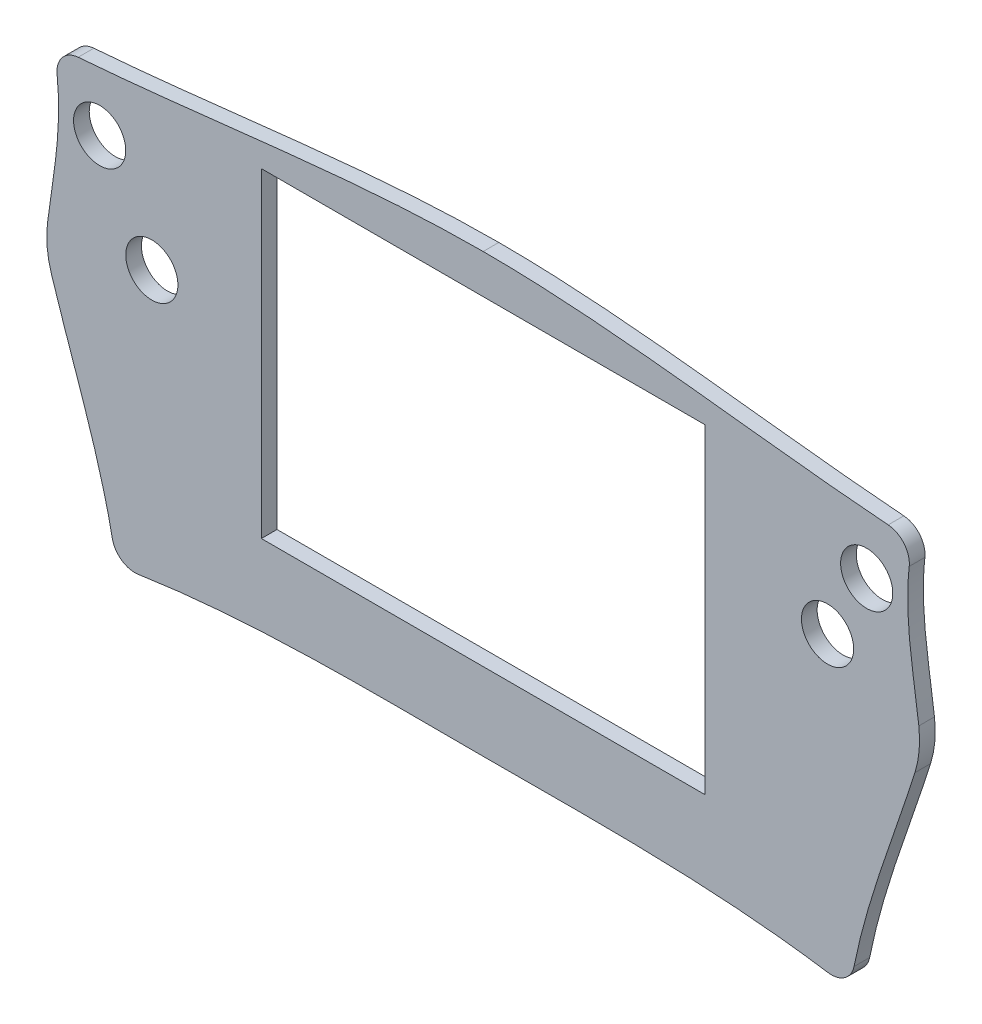
from build123d import *

# Parameters (mm, degrees)
SKETCH1_R           = 6.35
SKETCH1_W           = 107.95
SKETCH1_H           = 77.978
BOSS_EXTRUDE1_DEPTH = 3.81


with BuildPart() as part:
    # Sketch1 → Boss-Extrude1 (new body)
    with BuildSketch(Plane.XY):
        with BuildLine():
            ThreePointArc((-90.247945126, 1.580161299), (-87.975141882, -1.900637883), (-83.927585414, -2.848732901))
            add(Edge.make_bspline(
                [(-83.927585414, -2.848732901), (-83.054070471, -2.715786742), (-81.312732205, -2.460099658), (-78.654295906, -2.097457818), (-75.966491195, -1.758240891), (-72.336992818, -1.336160635), (-68.643939449, -0.959865866), (-65.583983691, -0.690535221), (-64.166779255, -0.573734085), (-63.566148315, -0.525577724), (-63.104217983, -0.489316665), (-62.699894104, -0.457970525), (-61.962459601, -0.401810292), (-60.915867879, -0.325087188), (-59.217621249, -0.20679221), (-57.068227268, -0.068668175), (-54.439670256, 0.082013873), (-51.767032951, 0.217415022), (-49.490906759, 0.318006821), (-48.009034739, 0.376639561), (-47.303600356, 0.403182815), (-46.87624745, 0.418937653), (-46.196192411, 0.443333549), (-45.175910497, 0.47801298), (-43.54019985, 0.529440772), (-41.442918551, 0.587830962), (-38.856544752, 0.647964805), (-36.195775126, 0.698343729), (-33.919375463, 0.73216057), (-32.406847373, 0.750213929), (-31.706246722, 0.757752509), (-31.408404648, 0.760817662), (-31.181163199, 0.763075054), (-31.021391801, 0.764629932), (-30.707730066, 0.767603553), (-30.26986268, 0.771505625), (-29.546357408, 0.777455403), (-28.619562792, 0.78413893), (-27.465024779, 0.791021083), (-25.871235622, 0.798660769), (-23.776420321, 0.805345875), (-21.095419523, 0.808788849), (-18.730229007, 0.807870354), (-16.988945077, 0.805198844), (-16.118237596, 0.803410927), (-15.586446283, 0.802172614), (-15.160582097, 0.801119107), (-14.629388092, 0.799779587), (-13.778859371, 0.797542602), (-12.290567631, 0.793391761), (-10.165619586, 0.786950406), (-7.609712384, 0.777596832), (-4.232901772, 0.76670962), (-1.692574695, 0.762894866), (-0.000735939, 0.762000495)],
                knots=[0.344883789, 0.344883789, 0.344883789, 0.344883789, 0.365355884, 0.385827978, 0.406300073, 0.426772167, 0.467716357, 0.488188451, 0.493306475, 0.498424499, 0.50098351, 0.503542522, 0.508660546, 0.518896593, 0.529132641, 0.549604735, 0.57007683, 0.590548924, 0.611021019, 0.621257066, 0.623816078, 0.62637509, 0.631493114, 0.641729161, 0.651965208, 0.672437303, 0.692909397, 0.713381492, 0.733853587, 0.744089634, 0.746648646, 0.749207658, 0.750487163, 0.751766669, 0.754325681, 0.759443705, 0.764561728, 0.774797776, 0.785033823, 0.79526987, 0.815741965, 0.83621406, 0.856686154, 0.866922202, 0.872040225, 0.874599237, 0.877158249, 0.882276272, 0.887394296, 0.897630343, 0.918102438, 0.938574533, 0.959046627, 0.999990816, 0.999990816, 0.999990816, 0.999990816], degree=3))
            add(Edge.make_bspline(
                [(-0.000735939, 0.762000495), (1.697316836, 0.766177734), (4.244409913, 0.77253852), (7.640476943, 0.781209392), (10.187668405, 0.787807526), (12.309879884, 0.793384892), (13.796306461, 0.797330932), (14.644321151, 0.799597123), (15.177550854, 0.80101974), (15.596748301, 0.802157809), (16.118287, 0.803504136), (16.973995966, 0.80545727), (18.68829658, 0.808424504), (21.027999055, 0.809635512), (23.697872289, 0.806345409), (25.799893716, 0.79962074), (27.409267347, 0.791849991), (28.580317931, 0.784820707), (29.525162279, 0.777971464), (30.265021199, 0.771870135), (30.715280941, 0.767851736), (31.035813921, 0.764814821), (31.203310927, 0.763185732), (31.424674383, 0.760990419), (31.725461502, 0.75790149), (32.424670998, 0.75038892), (33.939142843, 0.732342076), (36.215243056, 0.698563653), (38.877142881, 0.648210549), (41.464408025, 0.588096862), (43.562364845, 0.52972496), (45.199123553, 0.478290291), (46.218966314, 0.443646588), (46.900949422, 0.419191941), (47.325920748, 0.403533269), (48.032310107, 0.376969373), (49.513622078, 0.318385817), (51.790729101, 0.217796458), (54.463869347, 0.082412308), (57.093216384, -0.068273652), (59.243322334, -0.206412508), (60.942131401, -0.324720902), (61.989228303, -0.401465522), (62.726751965, -0.457620494), (63.131559362, -0.488998275), (63.592361081, -0.52516306), (64.193703385, -0.573365144), (65.61087209, -0.690141767), (68.671780552, -0.959508913), (72.365460908, -1.33583339), (75.995808252, -1.757987944), (78.68423516, -2.097273121), (81.343310776, -2.459998054), (83.085085672, -2.715750704), (83.958817154, -2.848731481)],
                knots=[9.152e-06, 9.152e-06, 9.152e-06, 9.152e-06, 0.040956877, 0.06143074, 0.081904603, 0.102378465, 0.112615397, 0.117733862, 0.122852328, 0.125411561, 0.127970794, 0.133089259, 0.143326191, 0.163800053, 0.184273916, 0.204747779, 0.21498471, 0.225221641, 0.235458573, 0.240577038, 0.245695504, 0.248254737, 0.249534353, 0.25081397, 0.253373202, 0.255932435, 0.266169367, 0.286643229, 0.307117092, 0.327590954, 0.348064817, 0.358301748, 0.36853868, 0.373657145, 0.376216378, 0.378775611, 0.389012542, 0.409486405, 0.429960268, 0.45043413, 0.470907993, 0.481144924, 0.491381856, 0.496500321, 0.499059554, 0.501618787, 0.506737253, 0.511855718, 0.532329581, 0.573277306, 0.593751169, 0.614225032, 0.634698894, 0.655172757, 0.655172757, 0.655172757, 0.655172757], degree=3))
            ThreePointArc((83.958817154, -2.848731481), (88.006379638, -1.900641004), (90.279187133, 1.58016116))
            add(Edge.make_bspline(
                [(90.279187133, 1.58016116), (90.707255223, 3.721330409), (91.671139987, 8.001579794), (93.903510476, 16.331728227), (97.14338237, 26.467199173), (100.58708015, 36.306691054), (103.244940111, 44.084996329), (104.500326759, 47.928352327), (105.108428455, 49.864950567)],
                knots=[-0.293557602, -0.293557602, -0.293557602, -0.293557602, -0.147731648, -0.001905695, 0.289746211, 0.581398118, 0.727224071, 0.873050024, 0.873050024, 0.873050024, 0.873050024], degree=3))
            ThreePointArc((105.108428455, 49.864950567), (106.136144084, 54.985756874), (106.061342514, 60.208137689))
            add(Edge.make_bspline(
                [(106.061342514, 60.208137689), (105.911666294, 61.444092118), (105.583988035, 63.887611007), (104.845109607, 68.962564326), (103.906894516, 75.52680744), (103.330597064, 82.448292199), (103.345249689, 87.49082735), (103.504349867, 90.423192606), (103.641008775, 91.919668099), (103.72344879, 92.661964135)],
                knots=[0.224037882, 0.224037882, 0.224037882, 0.224037882, 0.367934399, 0.511830915, 0.799623948, 1.087416981, 1.231313498, 1.303261756, 1.375210014, 1.375210014, 1.375210014, 1.375210014], degree=3))
            ThreePointArc((103.72344879, 92.661964135), (102.473247846, 96.843092134), (98.598214744, 98.850317136))
            add(Edge.make_bspline(
                [(98.598214744, 98.850317136), (94.416094473, 99.172048045), (86.049981349, 99.919191974), (69.422551197, 101.674055975), (48.779184165, 104.086919071), (28.344626534, 106.081432238), (12.109022695, 107.012529299), (4.052738444, 107.190075663), (0.015621033, 107.190075663)],
                knots=[0.21837869, 0.21837869, 0.21837869, 0.21837869, 0.316081353, 0.413784017, 0.609189345, 0.804594672, 0.902297336, 1, 1, 1, 1], degree=3))
            add(Edge.make_bspline(
                [(0.015621033, 107.190075663), (-4.021496378, 107.190075663), (-12.077780629, 107.012529299), (-28.313384468, 106.081432237), (-48.747942099, 104.08691907), (-69.39130913, 101.674055973), (-86.018739283, 99.919191972), (-94.384852407, 99.172048042), (-98.566972677, 98.850317134)],
                knots=[0, 0, 0, 0, 0.097702664, 0.195405328, 0.390810655, 0.586215983, 0.683918647, 0.78162131, 0.78162131, 0.78162131, 0.78162131], degree=3))
            ThreePointArc((-98.566972677, 98.850317134), (-102.442005779, 96.843092132), (-103.692206724, 92.661964133))
            add(Edge.make_bspline(
                [(-103.692206724, 92.661964133), (-103.609766709, 91.919668097), (-103.4731078, 90.423192604), (-103.314007622, 87.490827347), (-103.299354998, 82.448292195), (-103.875652451, 75.526807436), (-104.813867543, 68.962564321), (-105.552745972, 63.887611001), (-105.880424231, 61.444092112), (-106.030100451, 60.208137683)],
                knots=[-0.375210014, -0.375210014, -0.375210014, -0.375210014, -0.303261756, -0.231313498, -0.087416981, 0.200376052, 0.488169085, 0.632065601, 0.775962118, 0.775962118, 0.775962118, 0.775962118], degree=3))
            ThreePointArc((-106.030100451, 60.208137683), (-106.104902022, 54.985756873), (-105.077186396, 49.864950571))
            add(Edge.make_bspline(
                [(-105.077186396, 49.864950571), (-104.469084703, 47.928352336), (-103.213698061, 44.084996348), (-100.555838111, 36.306691093), (-97.112140347, 26.467199238), (-93.872268464, 16.33172832), (-91.63989798, 8.001579913), (-90.676013216, 3.721330541), (-90.247945126, 1.580161299)],
                knots=[0.126949976, 0.126949976, 0.126949976, 0.126949976, 0.272775929, 0.418601881, 0.710253787, 1.001905692, 1.147731645, 1.293557598, 1.293557598, 1.293557598, 1.293557598], degree=3))
        make_face()
        with Locations(Location((-93.338434532, 84.965075663, 0), (0, 0, 180))):
            Circle(SKETCH1_R, mode=Mode.SUBTRACT)
        with Locations(Location((93.369676598, 84.965075663, 0), (0, 0, 180))):
            Circle(SKETCH1_R, mode=Mode.SUBTRACT)
        with Locations(Location((-80.638434532, 62.968030407, 0), (0, 0, 180))):
            Circle(SKETCH1_R, mode=Mode.SUBTRACT)
        with Locations(Location((83.844676598, 68.467291721, 0), (0, 0, 180))):
            Circle(SKETCH1_R, mode=Mode.SUBTRACT)
        with Locations((0, 58.676075663)):
            Rectangle(SKETCH1_W, SKETCH1_H, mode=Mode.SUBTRACT)
    extrude(amount=BOSS_EXTRUDE1_DEPTH)


solid = part.part
